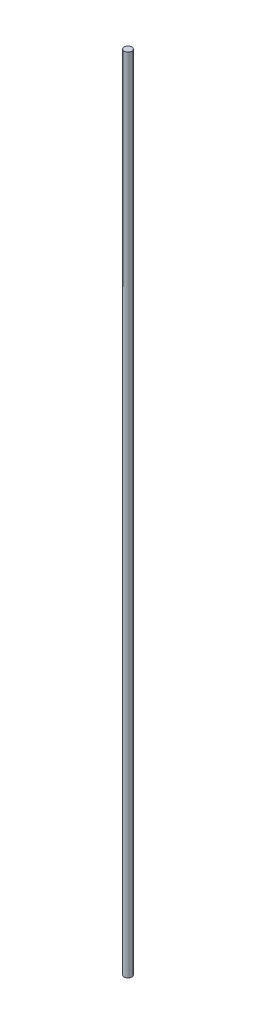
from build123d import *

# Parameters (mm, degrees)
SKETCH_2_W = 2.5
SKETCH_2_H = 529.4


with BuildPart() as part:
    # Эскиз2 → Повернуть1 (revolve)
    with BuildSketch(Plane.XY, mode=Mode.PRIVATE) as revolve_1_sk:
        with Locations((-1.25, 85.322255488)):
            Rectangle(SKETCH_2_W, SKETCH_2_H)
    revolve(revolve_1_sk.sketch.rotate(Axis((-2.5, 350.022255488, 0), (0, -1, 0)), 180), axis=Axis((-2.5, 350.022255488, 0), (0, -1, 0)))


solid = part.part
